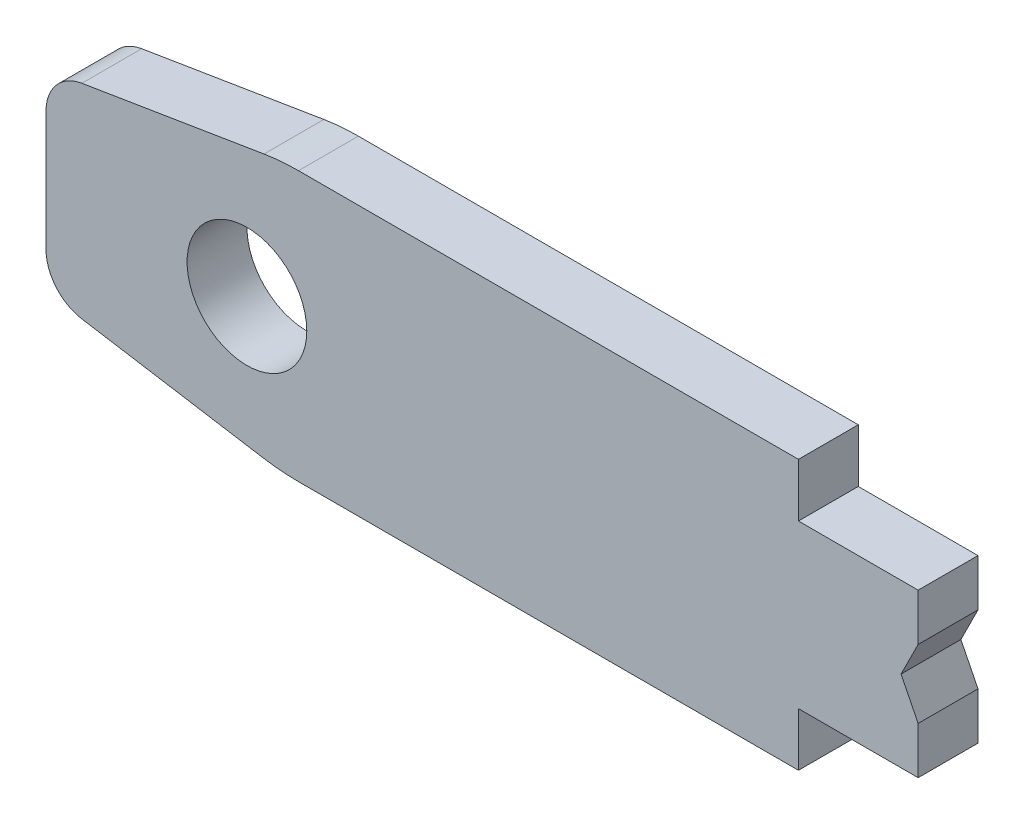
from build123d import *

# Parameters (mm, degrees)
ESBO_O1_R                = 1.4
RESSALTO_EXTRUS_O1_DEPTH = 1.4


with BuildPart() as part:
    # Esboço1 → Ressalto-extrusão1 (new body)
    with BuildSketch(Plane.XY):
        with BuildLine():
            Line((-5.101054411, 3.084372914), (-9.361488568, 2.387210962))
            ThreePointArc((-9.361488568, 2.387210962), (-9.9620658, 2.047835966), (-10.2, 1.400336379))
            Line((-10.2, 1.400336379), (-10.2, -1.400336379))
            ThreePointArc((-10.2, -1.400336379), (-9.9620658, -2.047835966), (-9.361488568, -2.387210962))
            Line((-9.361488568, -2.387210962), (-5.101054411, -3.084372914))
            ThreePointArc((-5.101054411, -3.084372914), (-4.698664301, -3.133566222), (-4.293611571, -3.15))
            Line((-4.293611571, -3.15), (7.4, -3.15))
            Line((7.4, -3.15), (7.4, -1.9))
            Line((7.4, -1.9), (10.2, -1.9))
            Line((10.2, -1.9), (10.2, -0.8))
            Line((10.2, -0.8), (9.8, 0))
            Line((9.8, 0), (10.2, 0.8))
            Line((10.2, 0.8), (10.2, 1.9))
            Line((10.2, 1.9), (7.4, 1.9))
            Line((7.4, 1.9), (7.4, 3.15))
            Line((7.4, 3.15), (-4.293611571, 3.15))
            ThreePointArc((-4.293611571, 3.15), (-4.698664301, 3.133566222), (-5.101054411, 3.084372914))
        make_face()
        with Locations((-5.5, 0)):
            Circle(ESBO_O1_R, mode=Mode.SUBTRACT)
    extrude(amount=RESSALTO_EXTRUS_O1_DEPTH)


solid = part.part
